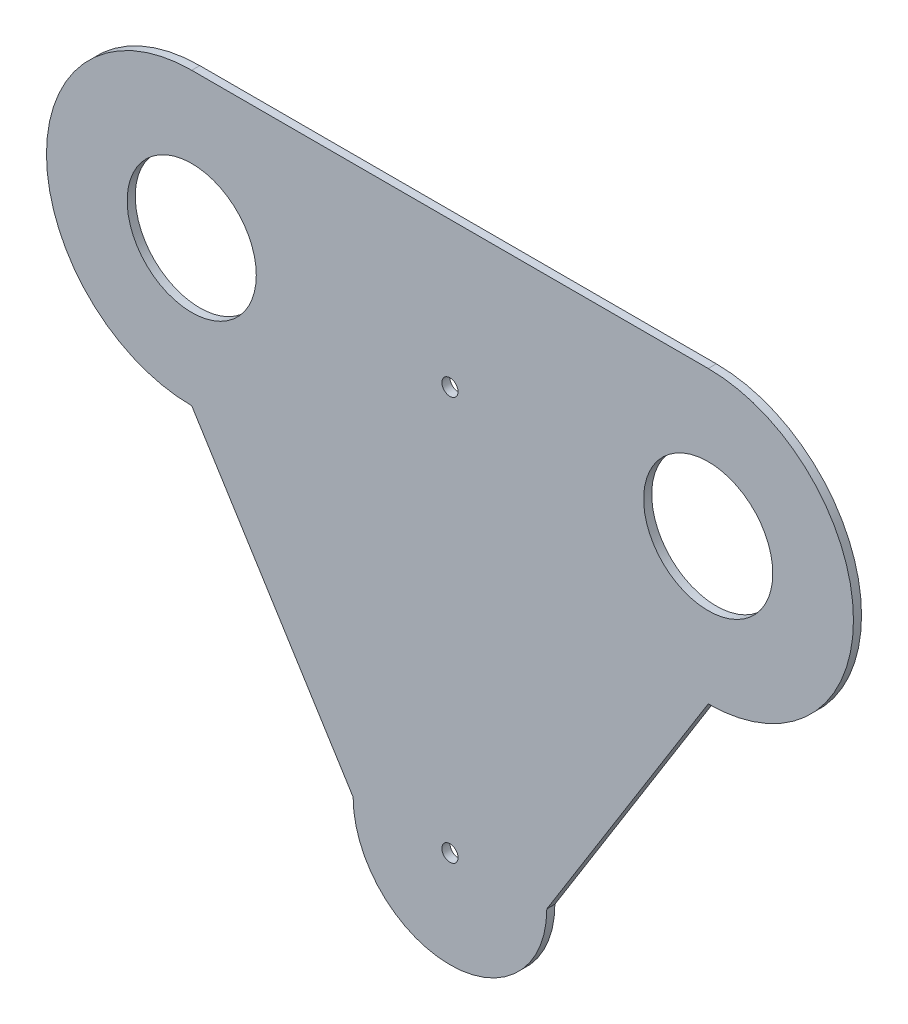
from build123d import *

# Parameters (mm, degrees)
SKETCH1_R           = 20
SKETCH1_R_2         = 2.5
BOSS_EXTRUDE1_DEPTH = 2.5


with BuildPart() as part:
    # Sketch1 → Boss-Extrude1 (new body)
    with BuildSketch(Plane.XY):
        with BuildLine():
            Line((-80, 45), (80, 45))
            ThreePointArc((80, 45), (125, 0), (80, -45))
            Line((80, -45), (30, -125))
            ThreePointArc((30, -125), (0, -155), (-30, -125))
            Line((-30, -125), (-80, -45))
            ThreePointArc((-80, -45), (-125, 0), (-80, 45))
        make_face()
        with Locations((-80, 0)):
            Circle(SKETCH1_R, mode=Mode.SUBTRACT)
        with Locations((80, 0)):
            Circle(SKETCH1_R, mode=Mode.SUBTRACT)
        Circle(SKETCH1_R_2, mode=Mode.SUBTRACT)
        with Locations((0, -125)):
            Circle(SKETCH1_R_2, mode=Mode.SUBTRACT)
    extrude(amount=BOSS_EXTRUDE1_DEPTH)


solid = part.part
